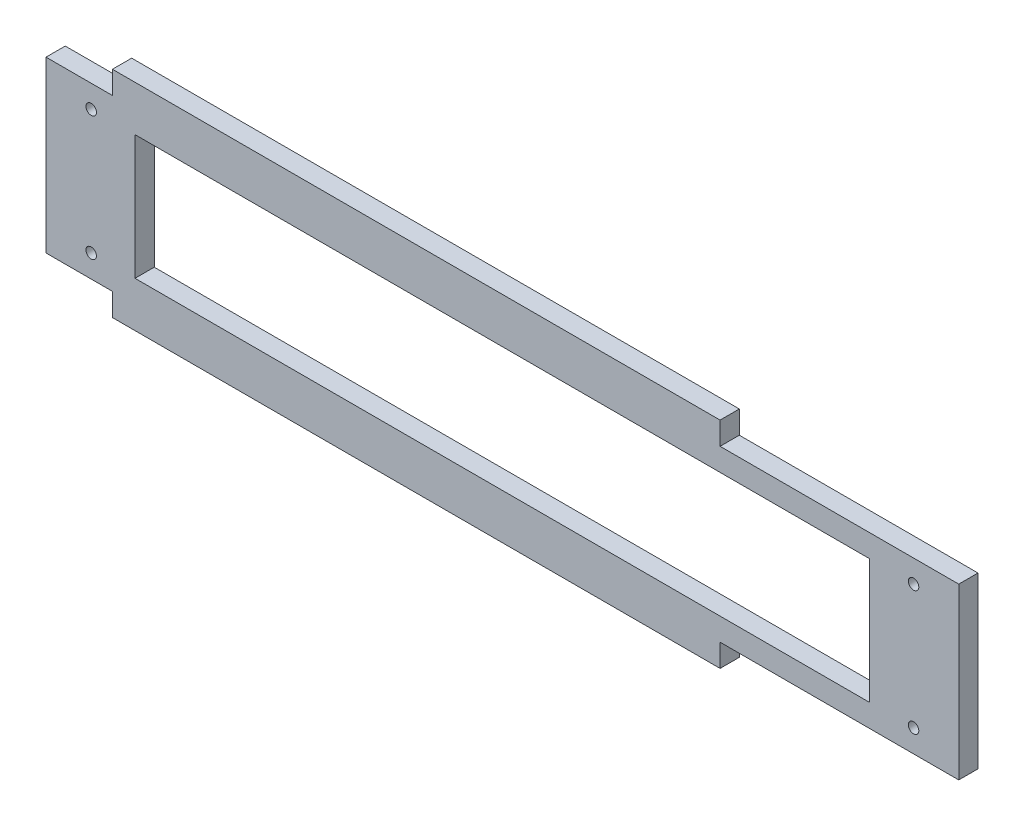
from build123d import *

# Parameters (mm, degrees)
SKETCH1_W           = 206.502
SKETCH1_H           = 34.9758
SKETCH1_R           = 1.4732
BOSS_EXTRUDE1_DEPTH = 5.4102


with BuildPart() as part:
    # Sketch1 → Boss-Extrude1 (new body)
    with BuildSketch(Plane.XY):
        Polygon((61.191000046, 23.8379), (61.191000046, 30.226), (-109.601, 30.226), (-109.601, 23.8379), (-128.27, 23.8379), (-128.27, -23.8379), (-109.601, -23.8379), (-109.601, -30.226), (61.191000046, -30.226), (61.191000046, -23.8379), (128.27, -23.8379), (128.27, 23.8379), align=None)
        Rectangle(SKETCH1_W, SKETCH1_H, mode=Mode.SUBTRACT)
        with Locations((-115.57, 17.4879)):
            Circle(SKETCH1_R, mode=Mode.SUBTRACT)
        with Locations((-115.57, -17.4879)):
            Circle(SKETCH1_R, mode=Mode.SUBTRACT)
        with Locations((115.57, -17.4879)):
            Circle(SKETCH1_R, mode=Mode.SUBTRACT)
        with Locations((115.57, 17.4879)):
            Circle(SKETCH1_R, mode=Mode.SUBTRACT)
    extrude(amount=BOSS_EXTRUDE1_DEPTH)


solid = part.part
